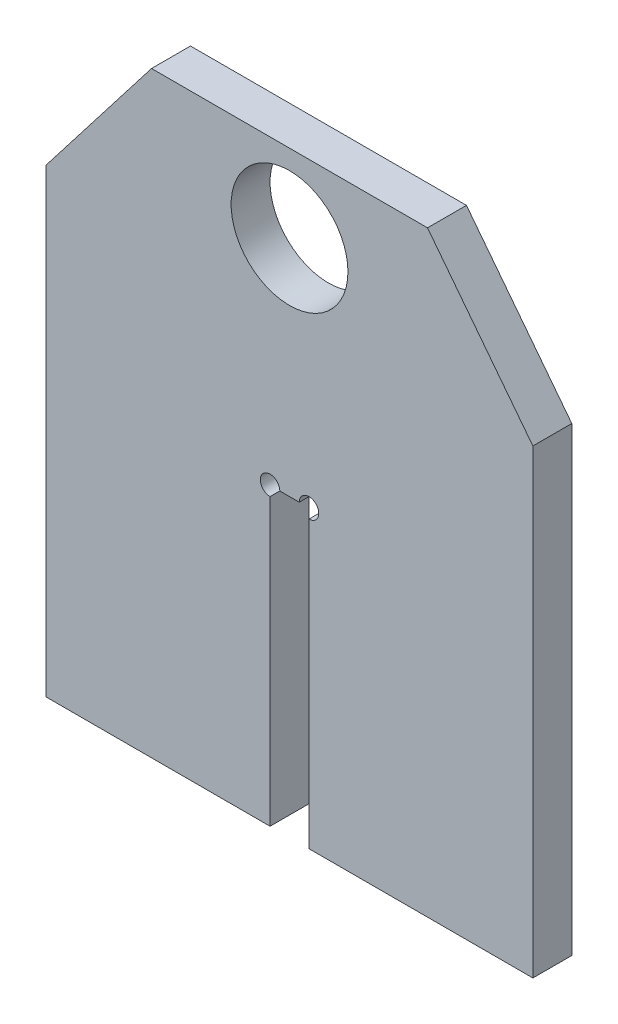
from build123d import *

# Parameters (mm, degrees)
SKETCH1_R           = 9
BOSS_EXTRUDE1_DEPTH = 6


with BuildPart() as part:
    # Sketch1 → Boss-Extrude1 (new body)
    with BuildSketch(Plane.XY):
        with BuildLine():
            Line((-37.5, -9), (-21.265472453, 12))
            Line((-21.265472453, 12), (21.265472453, 12))
            Line((21.265472453, 12), (37.5, -9))
            Line((37.5, -9), (37.5, -80))
            Line((37.5, -80), (3, -80))
            Line((3, -80), (3, -36))
            ThreePointArc((3, -36), (4.060660172, -33.439339828), (1.5, -34.5))
            Line((1.5, -34.5), (-1.5, -34.5))
            ThreePointArc((-1.5, -34.5), (-4.060660172, -33.439339828), (-3, -36))
            Line((-3, -36), (-3, -80))
            Line((-3, -80), (-37.5, -80))
            Line((-37.5, -80), (-37.5, -9))
        make_face()
        Circle(SKETCH1_R, mode=Mode.SUBTRACT)
    extrude(amount=BOSS_EXTRUDE1_DEPTH)


solid = part.part
